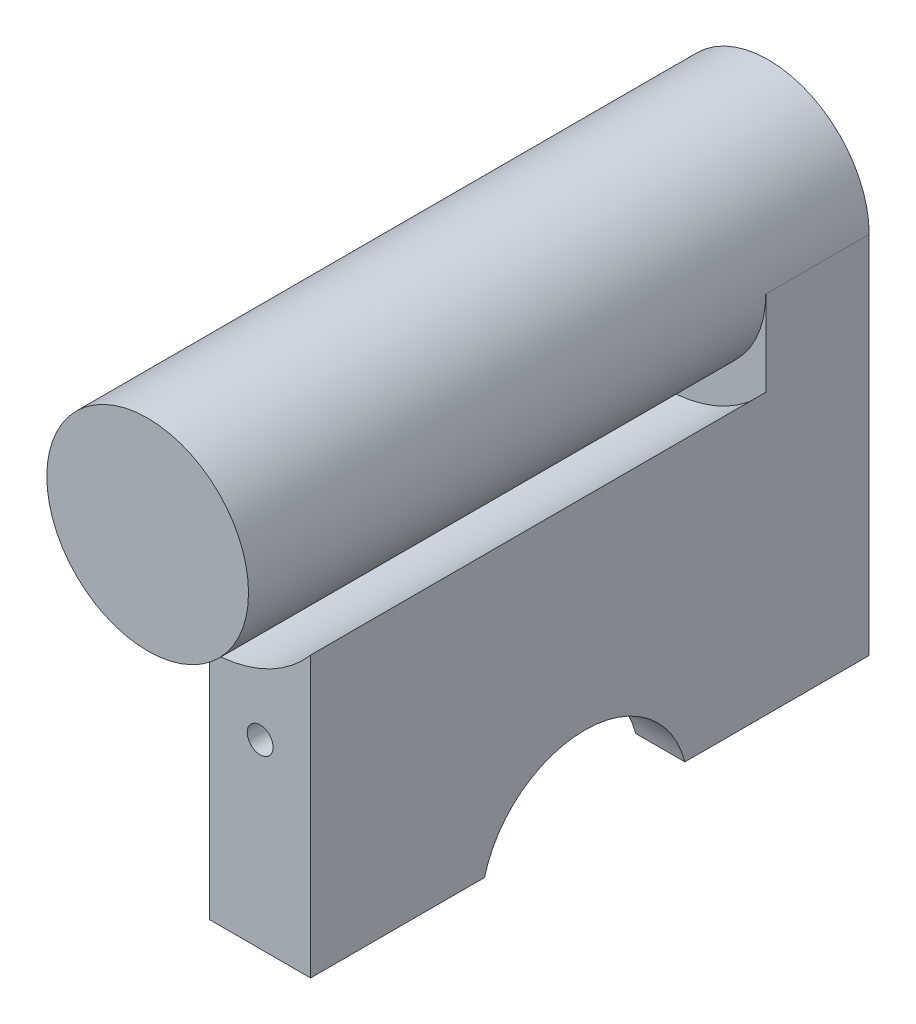
from build123d import *
from build123d.topology import SkipClean

# Parameters (mm, degrees)
SKETCH_1_R          = 1.95
EXTRUDE_1_DEPTH     = 12
SKETCH_4_W          = 2
SKETCH_4_H          = 9
EXTRUDE_2_DEPTH     = 1.95
EXTRUDE_4_DEPTH     = 8.8
SKETCH_9_R          = 2
CUT_EXTRUDE_2_DEPTH = 17
SKETCH_13_R         = 2.75
CUT_EXTRUDE_6_DEPTH = 1
CUT_EXTRUDE_7_DEPTH = 13.389713
SKETCH_14_R         = 0.25
CUT_EXTRUDE_8_DEPTH = 15.053647


with BuildPart() as part:
    # 스케치1 → 보스-돌출1 (new body)
    with BuildSketch(Plane.XY):
        Circle(SKETCH_1_R)
    extrude(amount=EXTRUDE_1_DEPTH)

    # 스케치4 → 보스-돌출2 (add)
    with BuildSketch(Plane(origin=(0, 0, 0), x_dir=(0, 0, -1), z_dir=(1, 0, 0))):
        with Locations((-1, -2.55)):
            Rectangle(SKETCH_4_W, SKETCH_4_H)
    extrude(amount=EXTRUDE_2_DEPTH)

    # 스케치8 → 보스-돌출4 (add)
    with BuildSketch(Plane.XY.offset(2)):
        with BuildLine():
            ThreePointArc((1.95, -1.643168), (1.075273, -2.312204), (0, -2.55))
            Line((0, -2.55), (0, -7.05))
            Line((0, -7.05), (1.95, -7.05))
            Line((1.95, -7.05), (1.95, -1.643168))
        make_face()
    extrude(amount=EXTRUDE_4_DEPTH)

    # 스케치9 → 컷-돌출2 (cut)
    with BuildSketch(Plane.ZY):
        with Locations((5.5, -7.55)):
            Circle(SKETCH_9_R)
    extrude(amount=-CUT_EXTRUDE_2_DEPTH, mode=Mode.SUBTRACT)

    # 스케치13 → 컷-돌출6 (cut)
    with BuildSketch(Plane.ZY):
        with Locations((5.505014, -7.55)):
            Circle(SKETCH_13_R)
    extrude(amount=-CUT_EXTRUDE_6_DEPTH, mode=Mode.SUBTRACT)

    # 스케치12 → 컷-돌출7 (cut, through all)
    with BuildSketch(Plane.XY.offset(2)):
        with BuildLine():
            Line((1.95, 0), (1.95, 1.95))
            Line((1.95, 1.95), (0, 1.95))
            ThreePointArc((0, 1.95), (1.378858, 1.378858), (1.95, 0))
        make_face()
    extrude(amount=-CUT_EXTRUDE_7_DEPTH, mode=Mode.SUBTRACT)

    # 스케치14 → 컷-돌출8 (cut, through all)
    with SkipClean():  # the faces are left unmerged after this step: merging them gives an invalid solid
        with BuildSketch(Plane(origin=(0, 0, 0), x_dir=(-1, 0, 0), z_dir=(0, 0, -1))):
            with Locations((-0.975, -3.55)):
                Circle(SKETCH_14_R)
        extrude(amount=-CUT_EXTRUDE_8_DEPTH, mode=Mode.SUBTRACT)


solid = part.part
